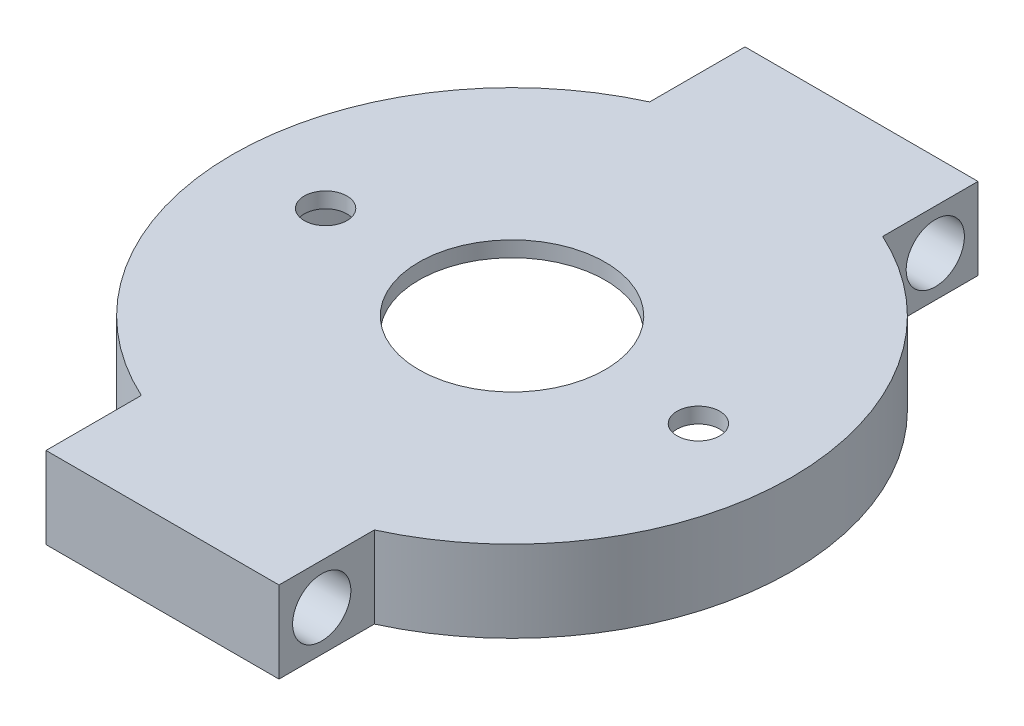
from build123d import *

# Parameters (mm, degrees)
SKETCH1_R           = 39.37
BOSS_EXTRUDE1_DEPTH = 13.335
SKETCH2_R           = 4.7625
CUT_EXTRUDE1_DEPTH  = 88.401931472
BOSS_EXTRUDE2_START = -2.54
SKETCH4_R           = 39.37
BOSS_EXTRUDE2_DEPTH = 2.54
SKETCH5_R           = 3.4925
CUT_EXTRUDE2_DEPTH  = 2.54
SKETCH6_R           = 15.24
CUT_EXTRUDE3_DEPTH  = 2.54


with BuildPart() as part:
    # Sketch1 → Boss-Extrude1 (new body)
    with BuildSketch(Plane(origin=(0, 0, 0), x_dir=(1, 0, 0), z_dir=(0, 1, 0))):
        with BuildLine():
            Line((-19.05, 57.15), (19.05, 57.15))
            Line((19.05, 57.15), (19.05, 41.562193157))
            ThreePointArc((19.05, 41.562193157), (45.72, 0), (19.05, -41.562193157))
            Line((19.05, -41.562193157), (19.05, -57.15))
            Line((19.05, -57.15), (-19.05, -57.15))
            Line((-19.05, -57.15), (-19.05, -41.562193157))
            ThreePointArc((-19.05, -41.562193157), (-45.72, 0), (-19.05, 41.562193157))
            Line((-19.05, 41.562193157), (-19.05, 57.15))
        make_face()
        with Locations(Location((0, 0, 0), (0, 0, 270))):
            Circle(SKETCH1_R, mode=Mode.SUBTRACT)
    extrude(amount=BOSS_EXTRUDE1_DEPTH)

    # Sketch2 → Cut-Extrude1 (cut, through all)
    with BuildSketch(Plane.ZY.offset(19.05)):
        with BuildLine():
            ThreePointArc((45.4025, 6.6675), (50.165, 1.905), (54.9275, 6.6675))
            Line((54.9275, 6.6675), (45.4025, 6.6675))
        make_face()
        with BuildLine():
            Line((45.4025, 6.6675), (54.9275, 6.6675))
            ThreePointArc((54.9275, 6.6675), (50.165, 11.43), (45.4025, 6.6675))
        make_face()
        with Locations((-50.165, 6.6675)):
            Circle(SKETCH2_R)
    extrude(amount=-CUT_EXTRUDE1_DEPTH, mode=Mode.SUBTRACT)

    # Sketch4 → Boss-Extrude2 (add)
    with BuildSketch(Plane(origin=(0, 13.335, 0), x_dir=(1, 0, 0), z_dir=(0, 1, 0)).offset(BOSS_EXTRUDE2_START)):
        with Locations(Location((0, 0, 0), (0, 0, 270))):
            Circle(SKETCH4_R)
    extrude(amount=BOSS_EXTRUDE2_DEPTH)

    # Sketch5 → Cut-Extrude2 (cut)
    with BuildSketch(Plane(origin=(0, 13.335, 0), x_dir=(1, 0, 0), z_dir=(0, 1, 0))):
        with Locations(Location((30.48, 0, 0), (0, 0, 270))):
            Circle(SKETCH5_R)
        with Locations(Location((-30.48, 0, 0), (0, 0, 270))):
            Circle(SKETCH5_R)
    extrude(amount=-CUT_EXTRUDE2_DEPTH, mode=Mode.SUBTRACT)

    # Sketch6 → Cut-Extrude3 (cut)
    with BuildSketch(Plane(origin=(0, 13.335, 0), x_dir=(1, 0, 0), z_dir=(0, 1, 0))):
        with Locations(Location((0, 0, 0), (0, 0, 270))):
            Circle(SKETCH6_R)
    extrude(amount=-CUT_EXTRUDE3_DEPTH, mode=Mode.SUBTRACT)


solid = part.part
